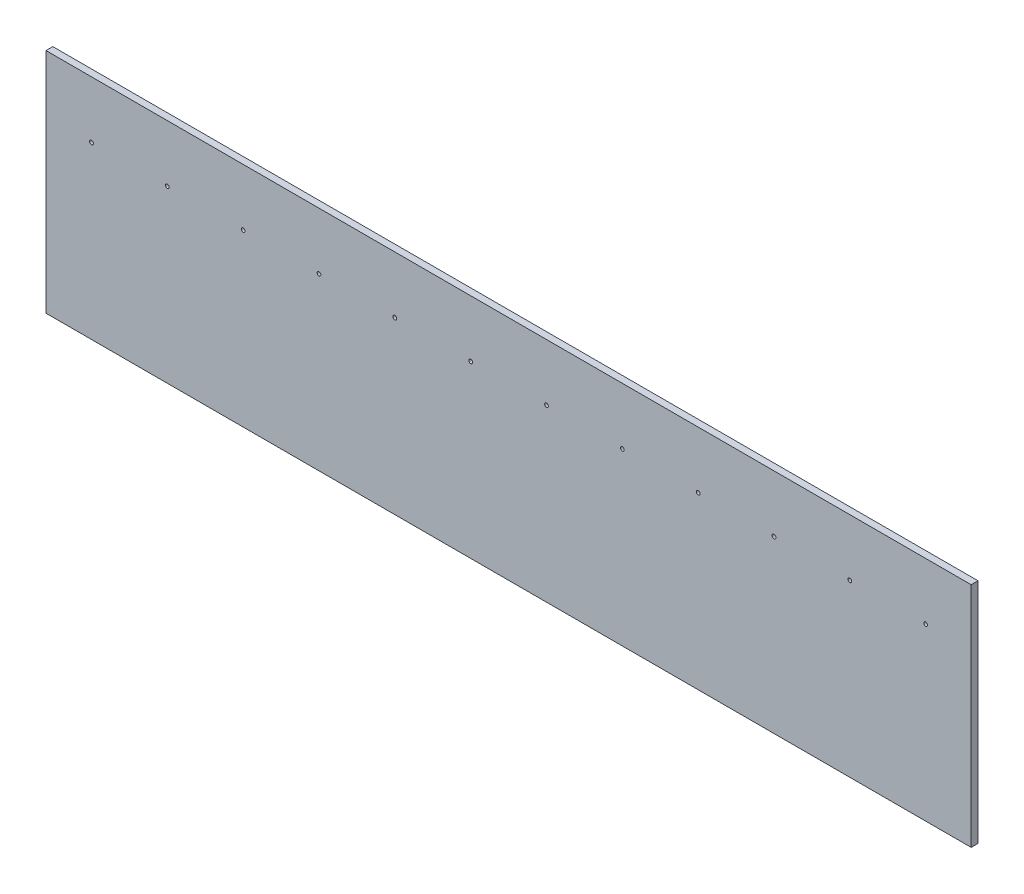
from build123d import *

# Parameters (mm, degrees)
SKETCH1_W           = 2440
SKETCH1_H           = 600
SKETCH1_R           = 5
BOSS_EXTRUDE1_DEPTH = 18


with BuildPart() as part:
    # Sketch1 → Boss-Extrude1 (new body)
    with BuildSketch(Plane.XY):
        with Locations((430.256410256, -41.025641026)):
            Rectangle(SKETCH1_W, SKETCH1_H)
        with Locations((-669.743589744, 108.974358974)):
            Circle(SKETCH1_R, mode=Mode.SUBTRACT)
        with Locations((-469.743589744, 108.974358974)):
            Circle(SKETCH1_R, mode=Mode.SUBTRACT)
        with Locations((-269.743589744, 108.974358974)):
            Circle(SKETCH1_R, mode=Mode.SUBTRACT)
        with Locations((-69.743589744, 108.974358974)):
            Circle(SKETCH1_R, mode=Mode.SUBTRACT)
        with Locations((130.256410256, 108.974358974)):
            Circle(SKETCH1_R, mode=Mode.SUBTRACT)
        with Locations((330.256410256, 108.974358974)):
            Circle(SKETCH1_R, mode=Mode.SUBTRACT)
        with Locations((530.256410256, 108.974358974)):
            Circle(SKETCH1_R, mode=Mode.SUBTRACT)
        with Locations((730.256410256, 108.974358974)):
            Circle(SKETCH1_R, mode=Mode.SUBTRACT)
        with Locations((930.256410256, 108.974358974)):
            Circle(SKETCH1_R, mode=Mode.SUBTRACT)
        with Locations((1130.256410256, 108.974358974)):
            Circle(SKETCH1_R, mode=Mode.SUBTRACT)
        with Locations((1330.256410256, 108.974358974)):
            Circle(SKETCH1_R, mode=Mode.SUBTRACT)
        with Locations((1530.256410256, 108.974358974)):
            Circle(SKETCH1_R, mode=Mode.SUBTRACT)
    extrude(amount=BOSS_EXTRUDE1_DEPTH)


solid = part.part
